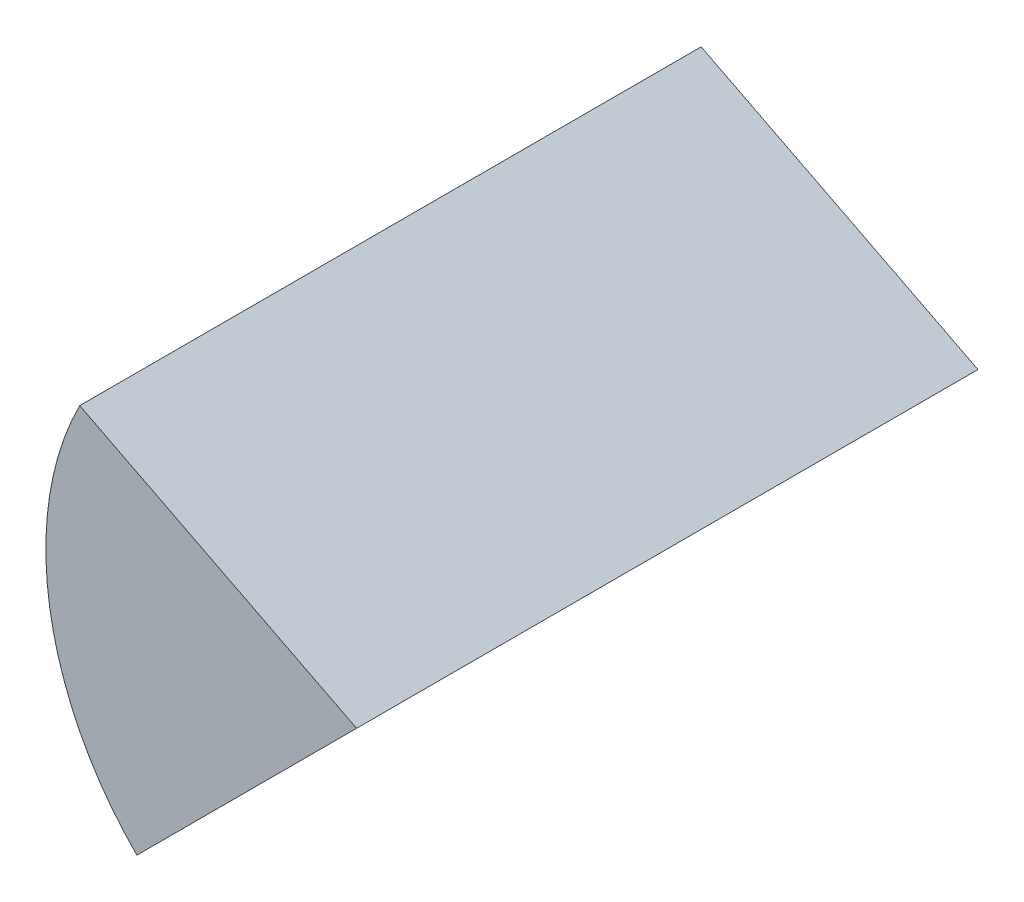
from build123d import *

# Parameters (mm, degrees)
SALIENTE_EXTRUIR1_DEPTH = 50
CROQUIS2_R              = 5
CORTAR_EXTRUIR1_DEPTH   = 10


with BuildPart() as part:
    # Croquis1 → Saliente-Extruir1 (new body)
    with BuildSketch(Plane.XY):
        with BuildLine():
            Line((0, 0), (-22.275163105, 11.349762493))
            ThreePointArc((-22.275163105, 11.349762493), (-24.692208515, -3.910861626), (-17.67766953, -17.67766953))
            Line((-17.67766953, -17.67766953), (0, 0))
        make_face()
    extrude(amount=SALIENTE_EXTRUIR1_DEPTH)

    # Croquis2 → Cortar-Extruir1 (cut)
    with BuildSketch(Plane(origin=(0, 0, 0), x_dir=(-1, 0, 0), z_dir=(0, 0, -1))):
        with Locations((15.309555307, -2.479336134)):
            Circle(CROQUIS2_R)
    extrude(amount=-CORTAR_EXTRUIR1_DEPTH, mode=Mode.SUBTRACT)


solid = part.part
